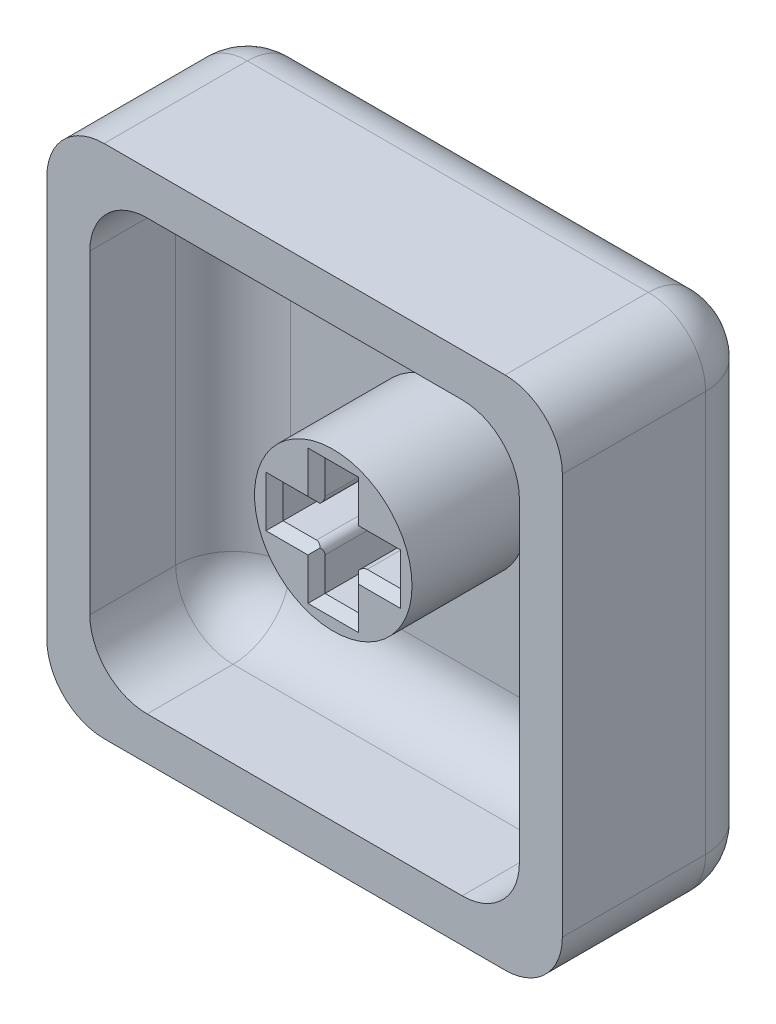
from build123d import *

# Parameters (mm, degrees)
SKETCH1_W           = 18
SKETCH1_H           = 18
BOSS_EXTRUDE1_DEPTH = 2
SKETCH1_4_R         = 2.75
BOSS_EXTRUDE2_DEPTH = 4
SKETCH1_5_W         = 18
SKETCH1_5_H         = 18
SKETCH1_5_W_2       = 15
SKETCH1_5_H_2       = 15
BOSS_EXTRUDE3_DEPTH = 5
CHAMFER1_SIZE       = 0.3
FILLET3_R           = 0.3
FILLET4_R           = 2


with BuildPart() as part:
    # Sketch1 → Boss-Extrude1 (new body)
    with BuildSketch(Plane.XY):
        Rectangle(SKETCH1_W, SKETCH1_H)
    extrude(amount=-BOSS_EXTRUDE1_DEPTH)

    # Sketch1<4> → Boss-Extrude2 (add)
    with BuildSketch(Plane.XY):
        Circle(SKETCH1_4_R)
        Polygon((-0.585, 0.585), (-0.585, 2.05), (0.585, 2.05), (0.585, 0.585), (2.05, 0.585), (2.05, -0.585), (0.585, -0.585), (0.585, -2.05), (-0.585, -2.05), (-0.585, -0.585), (-2.05, -0.585), (-2.05, 0.585), align=None, mode=Mode.SUBTRACT)
    extrude(amount=BOSS_EXTRUDE2_DEPTH)

    # Sketch1<5> → Boss-Extrude3 (add)
    with BuildSketch(Plane.XY):
        Rectangle(SKETCH1_5_W, SKETCH1_5_H)
        Rectangle(SKETCH1_5_W_2, SKETCH1_5_H_2, mode=Mode.SUBTRACT)
    extrude(amount=BOSS_EXTRUDE3_DEPTH)

    # Chamfer1
    chamfer1_edges = [part.edges().sort_by_distance(p)[0] for p in [
        (2.05, 0, 4),
        (1.3175, 0.585, 4),
        (0.585, 1.3175, 4),
        (0, 2.05, 4),
        (1.3175, -0.585, 4),
        (0.585, -1.3175, 4),
        (0, -2.05, 4),
        (-0.585, -1.3175, 4),
        (-1.3175, -0.585, 4),
        (-2.05, 0, 4),
        (-1.3175, 0.585, 4),
        (-0.585, 1.3175, 4),
    ]]
    chamfer(chamfer1_edges, length=CHAMFER1_SIZE)

    # Fillet3
    fillet3_edges = [part.edges().sort_by_distance(p)[0] for p in [
        (0.585, -0.585, 1.85),
        (0.585, 0.585, 1.85),
        (-0.585, 0.585, 1.85),
        (-0.585, -0.585, 1.85),
    ]]
    fillet(fillet3_edges, radius=FILLET3_R)

    # Fillet4
    fillet4_edges = [part.edges().sort_by_distance(p)[0] for p in [
        (0, -9, -2),
        (-9, 0, -2),
        (0, 9, -2),
        (9, 0, -2),
        (9, -9, 1.5),
        (9, 9, 1.5),
        (-9, -9, 1.5),
        (-9, 9, 1.5),
        (0, -7.5, 0),
        (7.5, 0, 0),
        (0, 7.5, 0),
        (-7.5, 0, 0),
        (-7.5, 7.5, 2.5),
        (7.5, 7.5, 2.5),
        (7.5, -7.5, 2.5),
        (-7.5, -7.5, 2.5),
    ]]
    fillet(fillet4_edges, radius=FILLET4_R)


solid = part.part
